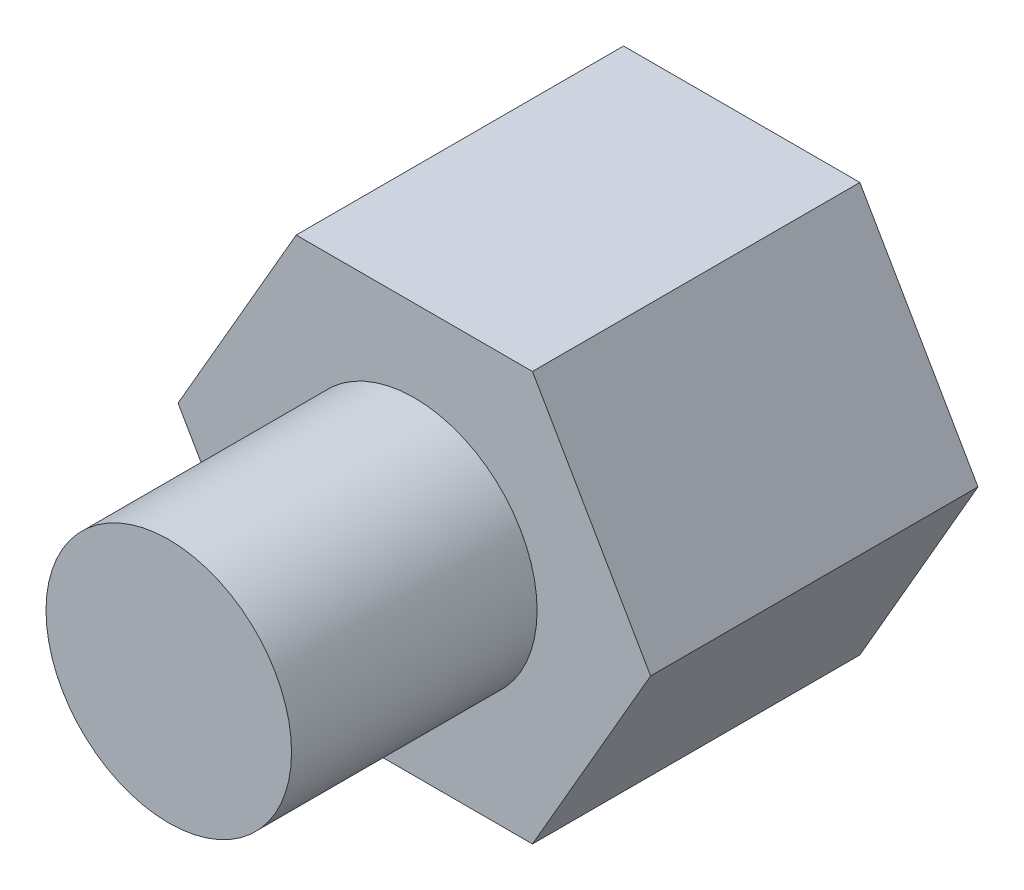
from build123d import *

# Parameters (mm, degrees)
BOSS_EXTRUDE1_DEPTH = 4
SKETCH2_R           = 1.5
CUT_EXTRUDE1_DEPTH  = 3
SKETCH3_R           = 1.5
BOSS_EXTRUDE2_DEPTH = 3


with BuildPart() as part:
    # Sketch1 → Boss-Extrude1 (new body)
    with BuildSketch(Plane.XY):
        Polygon((2.886751346, 0), (1.443375673, 2.5), (-1.443375673, 2.5), (-2.886751346, 0), (-1.443375673, -2.5), (1.443375673, -2.5), align=None)
    extrude(amount=BOSS_EXTRUDE1_DEPTH)

    # Sketch2 → Cut-Extrude1 (cut)
    with BuildSketch(Plane(origin=(0, 0, 0), x_dir=(-1, 0, 0), z_dir=(0, 0, -1))):
        Circle(SKETCH2_R)
    extrude(amount=-CUT_EXTRUDE1_DEPTH, mode=Mode.SUBTRACT)

    # Sketch3 → Boss-Extrude2 (add)
    with BuildSketch(Plane.XY.offset(4)):
        with Locations(Location((0, 0, 0), (0, 0, 180))):
            Circle(SKETCH3_R)
    extrude(amount=BOSS_EXTRUDE2_DEPTH)


solid = part.part
